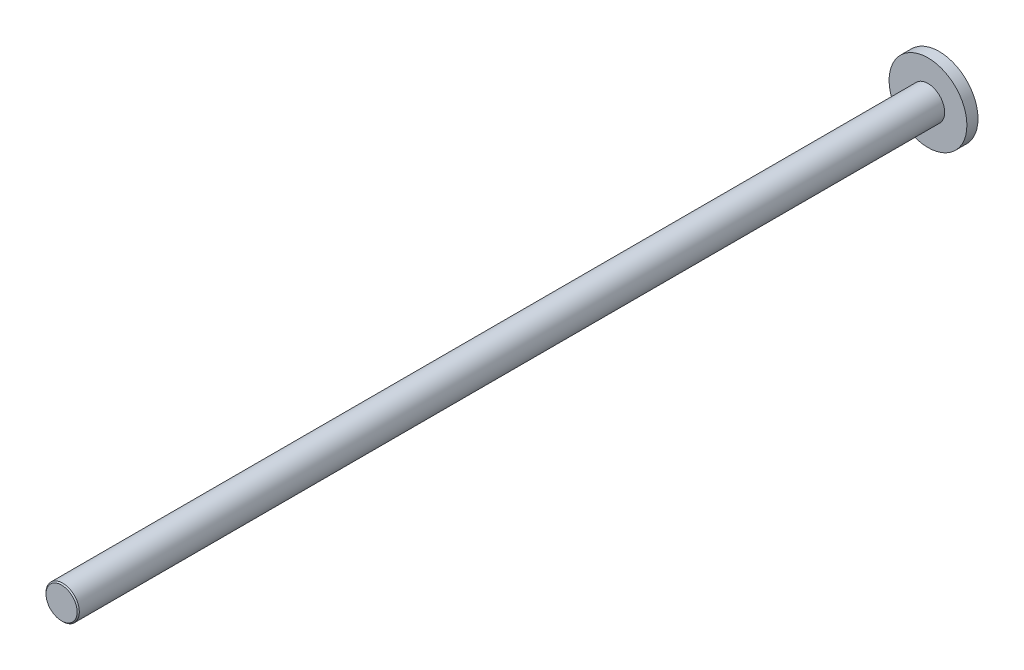
from build123d import *

# Parameters (mm, degrees)
SKETCH2_R           = 3.5
BOSS_EXTRUDE1_DEPTH = 1
SKETCH3_R           = 1.5
BOSS_EXTRUDE2_DEPTH = 78
CHAMFER1_SIZE       = 0.1


with BuildPart() as part:
    # Sketch2 → Boss-Extrude1 (new body)
    with BuildSketch(Plane.XY):
        Circle(SKETCH2_R)
    extrude(amount=BOSS_EXTRUDE1_DEPTH)

    # Sketch3 → Boss-Extrude2 (add)
    with BuildSketch(Plane.XY.offset(1)):
        Circle(SKETCH3_R)
    extrude(amount=BOSS_EXTRUDE2_DEPTH)

    # Chamfer1
    chamfer1_edges = [part.edges().sort_by_distance(p)[0] for p in [
        (-1.5, 0, 79),
    ]]
    chamfer(chamfer1_edges, length=CHAMFER1_SIZE)


solid = part.part
